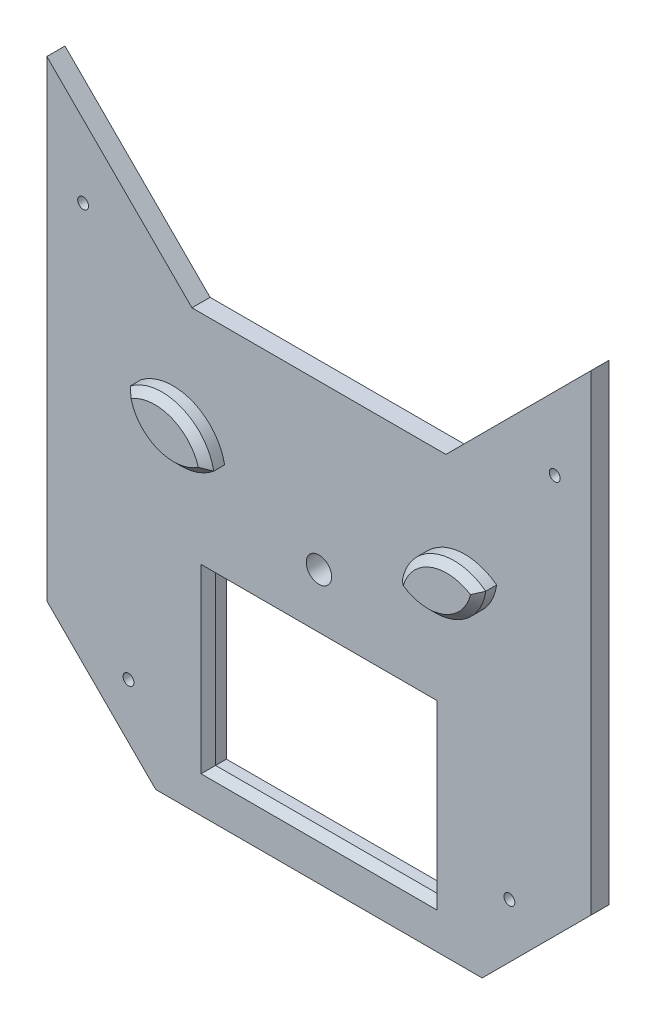
from build123d import *

# Parameters (mm, degrees)
IZIM1_R                          = 3.5
IZIM1_W                          = 61
IZIM1_H                          = 46
Y_KSEKLIK_EKSTR_ZYON1_DEPTH      = 5
Y_KSEKLIK_EKSTR_ZYON2_DEPTH      = 5
Y_KSEKLIK_EKSTR_ZYON2_DEPTH_BACK = 5
PAH1_SIZE                        = 2
PAH2_SIZE                        = 2
IZIM5_R                          = 1.5
KES_EKSTR_ZYON1_DEPTH            = 10


with BuildPart() as part:
    # Çizim1 → Yükseklik-Ekstrüzyon1 (new body)
    with BuildSketch(Plane.XY):
        Polygon((-75, 70), (-75, 110), (-35, 70), (35, 70), (75, 110), (75, 70), (75, -20), (45, -50), (-45, -50), (-75, -20), align=None)
        with Locations((0, 25)):
            Circle(IZIM1_R, mode=Mode.SUBTRACT)
        with Locations((0, -15)):
            Rectangle(IZIM1_W, IZIM1_H, mode=Mode.SUBTRACT)
        with BuildLine():
            ThreePointArc((-26, 37), (-35.043252773, 47.813379198), (-49, 45.833783979))
            ThreePointArc((-49, 45.833783979), (-40.097413612, 34.654160049), (-26, 37))
        make_face(mode=Mode.SUBTRACT)
        with BuildLine():
            ThreePointArc((26, 37), (40.097413612, 34.654160049), (49, 45.833783979))
            ThreePointArc((49, 45.833783979), (35.043252773, 47.813379198), (26, 37))
        make_face(mode=Mode.SUBTRACT)
    extrude(amount=Y_KSEKLIK_EKSTR_ZYON1_DEPTH)

    # Çizim3 → Yükseklik-Ekstrüzyon2 (add, two sides: drawn at the far end of the back side and taken through both)
    with BuildSketch(Plane.XY.offset(5).offset(-Y_KSEKLIK_EKSTR_ZYON2_DEPTH_BACK)):
        with BuildLine():
            ThreePointArc((-26, 37), (-40.097413612, 34.654160049), (-49, 45.833783979))
            ThreePointArc((-49, 45.833783979), (-35.043252773, 47.813379198), (-26, 37))
        make_face()
        with BuildLine():
            ThreePointArc((26, 37), (35.043252773, 47.813379198), (49, 45.833783979))
            ThreePointArc((49, 45.833783979), (40.097413612, 34.654160049), (26, 37))
        make_face()
    extrude(amount=Y_KSEKLIK_EKSTR_ZYON2_DEPTH + Y_KSEKLIK_EKSTR_ZYON2_DEPTH_BACK)

    # Pah1
    pah1_edges = [part.edges().sort_by_distance(p)[0] for p in [
        (-35.043252773, 47.813379198, 10),
        (-40.097413612, 34.654160049, 10),
        (40.097413612, 34.654160049, 10),
        (35.043252773, 47.813379198, 10),
    ]]
    chamfer(pah1_edges, length=PAH1_SIZE)

    # Pah2
    pah2_edges = [part.edges().sort_by_distance(p)[0] for p in [
        (30.5, -15, 5),
        (0, 8, 5),
        (-30.5, -15, 5),
        (0, -38, 5),
    ]]
    chamfer(pah2_edges, length=PAH2_SIZE)

    # Çizim5 → Kes-Ekstrüzyon1 (cut)
    with BuildSketch(Plane.XY.offset(5)):
        with Locations((-65, 80)):
            Circle(IZIM5_R)
        with Locations((-52.5, -27.5)):
            Circle(IZIM5_R)
        with Locations(Location((52.5, -27.5, 0), (0, 0, 180))):
            Circle(IZIM5_R)
        with Locations(Location((65, 80, 0), (0, 0, 180))):
            Circle(IZIM5_R)
    extrude(amount=-KES_EKSTR_ZYON1_DEPTH, mode=Mode.SUBTRACT)


solid = part.part
